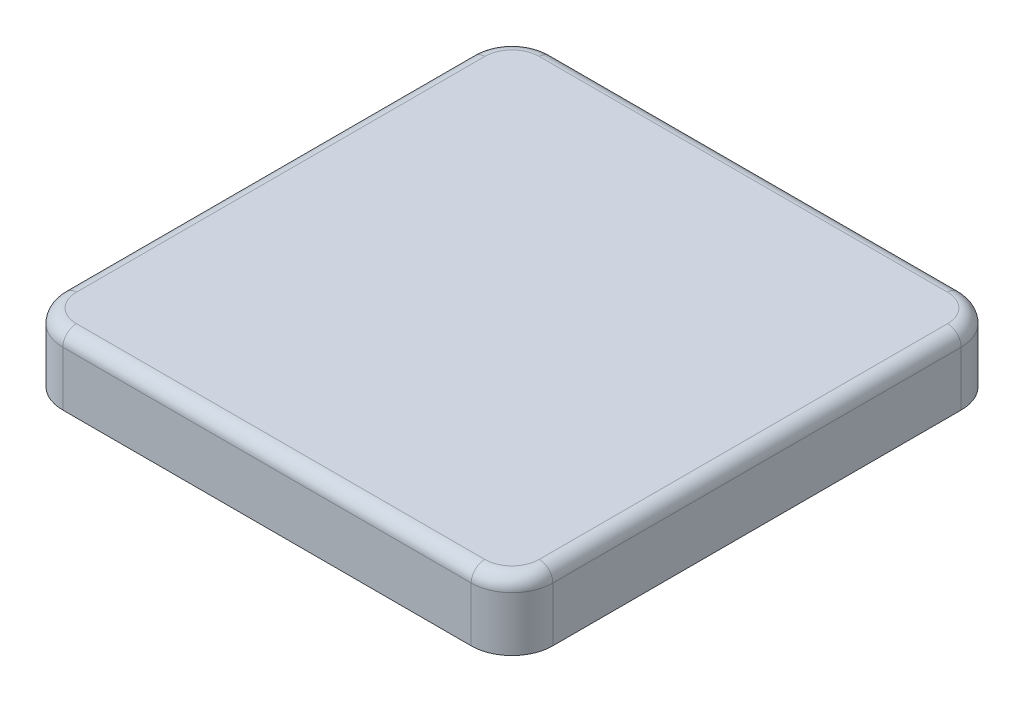
from build123d import *

# Parameters (mm, degrees)
BOSS_EXTRUDE1_DEPTH = 5
SHELL1_T            = -2
FILLET1_R           = 1
SKETCH2_R           = 13.5
BOSS_EXTRUDE2_DEPTH = 3


with BuildPart() as part:
    # Sketch1 → Boss-Extrude1 (new body)
    with BuildSketch(Plane(origin=(0, 0, 0), x_dir=(1, 0, 0), z_dir=(0, 1, 0))):
        with BuildLine():
            Line((-15, -18), (15, -18))
            ThreePointArc((15, -18), (17.121320344, -17.121320344), (18, -15))
            Line((18, -15), (18, 15))
            ThreePointArc((18, 15), (17.121320344, 17.121320344), (15, 18))
            Line((15, 18), (-15, 18))
            ThreePointArc((-15, 18), (-17.121320344, 17.121320344), (-18, 15))
            Line((-18, 15), (-18, -15))
            ThreePointArc((-18, -15), (-17.121320344, -17.121320344), (-15, -18))
        make_face()
    extrude(amount=BOSS_EXTRUDE1_DEPTH)

    # Shell1
    shell1_openings = [part.faces().sort_by_distance(p)[0] for p in [
        (0, 0, 0),
    ]]
    offset(amount=SHELL1_T, openings=shell1_openings, kind=Kind.INTERSECTION)

    # Fillet1
    fillet1_edges = [part.edges().sort_by_distance(p)[0] for p in [
        (17.121320344, 5, 17.121320344),
        (18, 5, 0),
        (17.121320344, 5, -17.121320344),
        (0, 5, -18),
        (-17.121320344, 5, -17.121320344),
        (-18, 5, 0),
        (-17.121320344, 5, 17.121320344),
        (0, 5, 18),
    ]]
    fillet(fillet1_edges, radius=FILLET1_R)

    # Sketch2 → Boss-Extrude2 (add)
    with BuildSketch(Plane.XZ.offset(-3)):
        with Locations(Location((0, 0, 0), (0, 0, 270))):
            Circle(SKETCH2_R)
    extrude(amount=BOSS_EXTRUDE2_DEPTH)


solid = part.part
